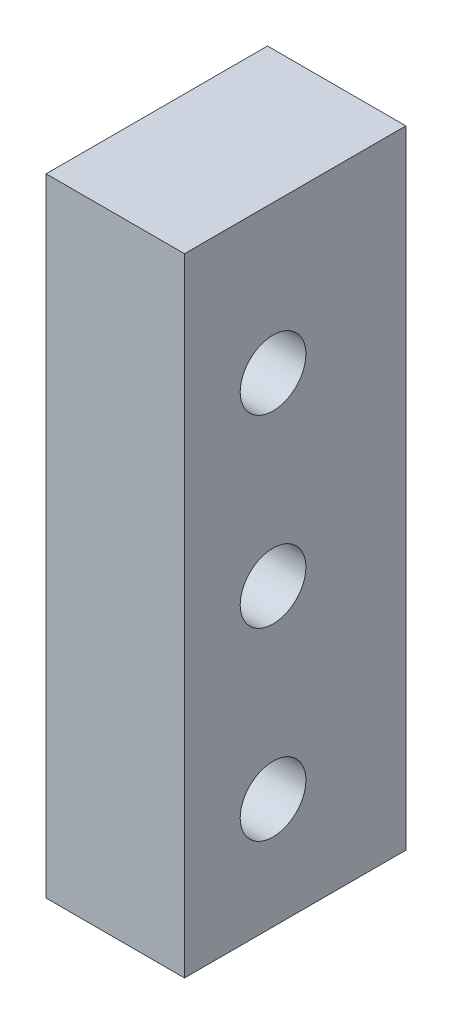
from build123d import *

# Parameters (mm, degrees)
SKETCH1_W           = 7.62
SKETCH1_H           = 21.59
SKETCH1_R           = 1.1303
BOSS_EXTRUDE1_DEPTH = 4.7625


with BuildPart() as part:
    # Sketch1 → Boss-Extrude1 (new body)
    with BuildSketch(Plane(origin=(0, 0, 0), x_dir=(0, 0, -1), z_dir=(1, 0, 0))):
        with Locations((1.222630258, -0.739603457)):
            Rectangle(SKETCH1_W, SKETCH1_H)
        with Locations(Location((0.460630258, 4.975396543, 0), (0, 0, 180))):
            Circle(SKETCH1_R, mode=Mode.SUBTRACT)
        with Locations(Location((0.460630258, -1.374603457, 0), (0, 0, 180))):
            Circle(SKETCH1_R, mode=Mode.SUBTRACT)
        with Locations(Location((0.460630258, -7.724603457, 0), (0, 0, 180))):
            Circle(SKETCH1_R, mode=Mode.SUBTRACT)
    extrude(amount=BOSS_EXTRUDE1_DEPTH)


solid = part.part
